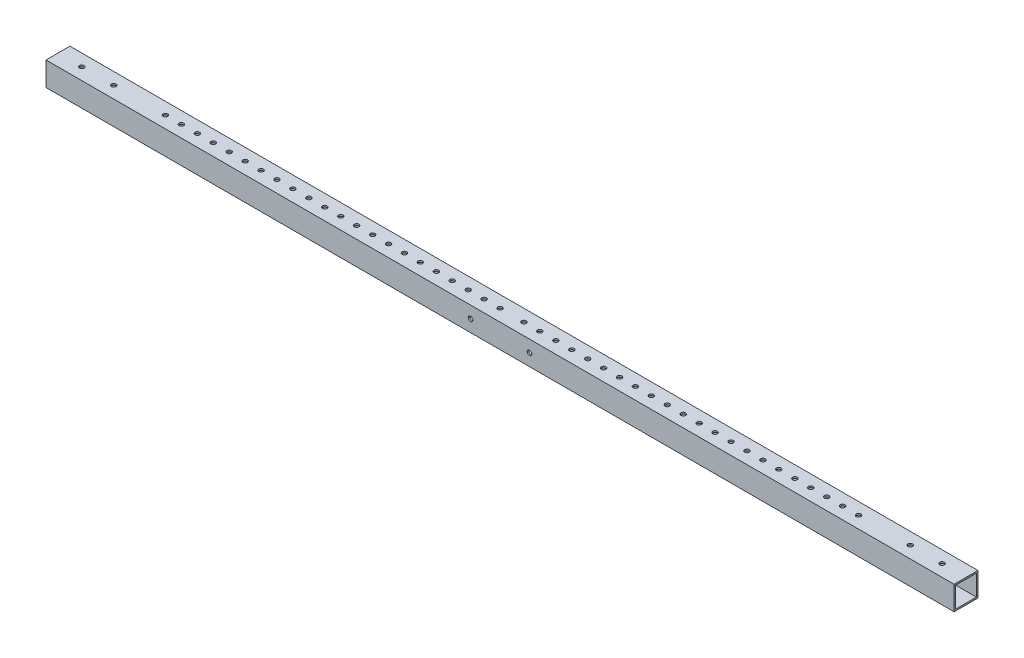
from build123d import *

# Parameters (mm, degrees)
SKETCH_11_W         = 15
SKETCH_11_H         = 15
SKETCH_11_W_2       = 13
SKETCH_11_H_2       = 13
F_15X15X1_1_DEPTH   = 570
SKETCH_12_R         = 1.45
CUT_EXTRUDE_1_DEPTH = 286.49299466
SKETCH_13_R         = 1.45
CUT_EXTRUDE_2_DEPTH = 286.49299466
SKETCH_14_R         = 1.45
CUT_EXTRUDE_3_DEPTH = 286.49299466


with BuildPart() as part:
    # 草图11 → 铝管 15X15X1(1) (new body)
    with BuildSketch(Plane(origin=(-285, 0, 0), x_dir=(0, 0, -1), z_dir=(1, 0, 0))):
        Rectangle(SKETCH_11_W, SKETCH_11_H)
        Rectangle(SKETCH_11_W_2, SKETCH_11_H_2, mode=Mode.SUBTRACT)
    extrude(amount=F_15X15X1_1_DEPTH)

    # 草图12 → 切除-拉伸1 (cut, through all)
    with BuildSketch(Plane(origin=(0, 7.5, 0), x_dir=(1, 0, 0), z_dir=(0, 1, 0))):
        with Locations(Location((-270, 0, 0), (0, 0, 270))):
            Circle(SKETCH_12_R)
        with Locations(Location((-250, 0, 0), (0, 0, 270))):
            Circle(SKETCH_12_R)
        with Locations(Location((250, 0, 0), (0, 0, 90))):
            Circle(SKETCH_12_R)
        with Locations(Location((270, 0, 0), (0, 0, 90))):
            Circle(SKETCH_12_R)
    extrude(amount=-CUT_EXTRUDE_1_DEPTH, mode=Mode.SUBTRACT)

    # 草图13 → 切除-拉伸2 (cut, through all)
    with BuildSketch(Plane(origin=(0, 0, -7.5), x_dir=(-1, 0, 0), z_dir=(0, 0, -1))):
        with Locations((-18.5, 0)):
            Circle(SKETCH_13_R)
        with Locations((18.5, 0)):
            Circle(SKETCH_13_R)
    extrude(amount=-CUT_EXTRUDE_2_DEPTH, mode=Mode.SUBTRACT)

    # 草图14 → 切除-拉伸3 (cut, through all)
    with BuildSketch(Plane.XZ.offset(7.5)):
        with Locations(Location((-97.5, 0, 0), (0, 0, 270))):
            Circle(SKETCH_14_R)
        with Locations(Location((-87.5, 0, 0), (0, 0, 270))):
            Circle(SKETCH_14_R)
        with Locations(Location((-117.5, 0, 0), (0, 0, 270))):
            Circle(SKETCH_14_R)
        with Locations(Location((-107.5, 0, 0), (0, 0, 270))):
            Circle(SKETCH_14_R)
        with Locations(Location((-137.5, 0, 0), (0, 0, 270))):
            Circle(SKETCH_14_R)
        with Locations(Location((-127.5, 0, 0), (0, 0, 270))):
            Circle(SKETCH_14_R)
        with Locations(Location((-157.5, 0, 0), (0, 0, 270))):
            Circle(SKETCH_14_R)
        with Locations(Location((-147.5, 0, 0), (0, 0, 270))):
            Circle(SKETCH_14_R)
        with Locations(Location((-177.5, 0, 0), (0, 0, 270))):
            Circle(SKETCH_14_R)
        with Locations(Location((-167.5, 0, 0), (0, 0, 270))):
            Circle(SKETCH_14_R)
        with Locations(Location((-197.5, 0, 0), (0, 0, 270))):
            Circle(SKETCH_14_R)
        with Locations(Location((-187.5, 0, 0), (0, 0, 270))):
            Circle(SKETCH_14_R)
        with Locations(Location((-217.5, 0, 0), (0, 0, 270))):
            Circle(SKETCH_14_R)
        with Locations(Location((-207.5, 0, 0), (0, 0, 270))):
            Circle(SKETCH_14_R)
        with Locations(Location((-77.5, 0, 0), (0, 0, 270))):
            Circle(SKETCH_14_R)
        with Locations(Location((-67.5, 0, 0), (0, 0, 270))):
            Circle(SKETCH_14_R)
        with Locations(Location((-57.5, 0, 0), (0, 0, 270))):
            Circle(SKETCH_14_R)
        with Locations(Location((-47.5, 0, 0), (0, 0, 270))):
            Circle(SKETCH_14_R)
        with Locations(Location((-37.5, 0, 0), (0, 0, 270))):
            Circle(SKETCH_14_R)
        with Locations(Location((-27.5, 0, 0), (0, 0, 270))):
            Circle(SKETCH_14_R)
        with Locations(Location((-17.5, 0, 0), (0, 0, 270))):
            Circle(SKETCH_14_R)
        with Locations(Location((-7.5, 0, 0), (0, 0, 270))):
            Circle(SKETCH_14_R)
        with Locations(Location((7.5, 0, 0), (0, 0, 270))):
            Circle(SKETCH_14_R)
        with Locations(Location((17.5, 0, 0), (0, 0, 270))):
            Circle(SKETCH_14_R)
        with Locations(Location((27.5, 0, 0), (0, 0, 270))):
            Circle(SKETCH_14_R)
        with Locations(Location((37.5, 0, 0), (0, 0, 270))):
            Circle(SKETCH_14_R)
        with Locations(Location((47.5, 0, 0), (0, 0, 270))):
            Circle(SKETCH_14_R)
        with Locations(Location((57.5, 0, 0), (0, 0, 270))):
            Circle(SKETCH_14_R)
        with Locations(Location((67.5, 0, 0), (0, 0, 270))):
            Circle(SKETCH_14_R)
        with Locations(Location((77.5, 0, 0), (0, 0, 270))):
            Circle(SKETCH_14_R)
        with Locations(Location((207.5, 0, 0), (0, 0, 270))):
            Circle(SKETCH_14_R)
        with Locations(Location((217.5, 0, 0), (0, 0, 270))):
            Circle(SKETCH_14_R)
        with Locations(Location((187.5, 0, 0), (0, 0, 270))):
            Circle(SKETCH_14_R)
        with Locations(Location((197.5, 0, 0), (0, 0, 270))):
            Circle(SKETCH_14_R)
        with Locations(Location((167.5, 0, 0), (0, 0, 270))):
            Circle(SKETCH_14_R)
        with Locations(Location((177.5, 0, 0), (0, 0, 270))):
            Circle(SKETCH_14_R)
        with Locations(Location((147.5, 0, 0), (0, 0, 270))):
            Circle(SKETCH_14_R)
        with Locations(Location((157.5, 0, 0), (0, 0, 270))):
            Circle(SKETCH_14_R)
        with Locations(Location((127.5, 0, 0), (0, 0, 270))):
            Circle(SKETCH_14_R)
        with Locations(Location((137.5, 0, 0), (0, 0, 270))):
            Circle(SKETCH_14_R)
        with Locations(Location((107.5, 0, 0), (0, 0, 270))):
            Circle(SKETCH_14_R)
        with Locations(Location((117.5, 0, 0), (0, 0, 270))):
            Circle(SKETCH_14_R)
        with Locations(Location((87.5, 0, 0), (0, 0, 270))):
            Circle(SKETCH_14_R)
        with Locations(Location((97.5, 0, 0), (0, 0, 270))):
            Circle(SKETCH_14_R)
    extrude(amount=-CUT_EXTRUDE_3_DEPTH, mode=Mode.SUBTRACT)


solid = part.part
